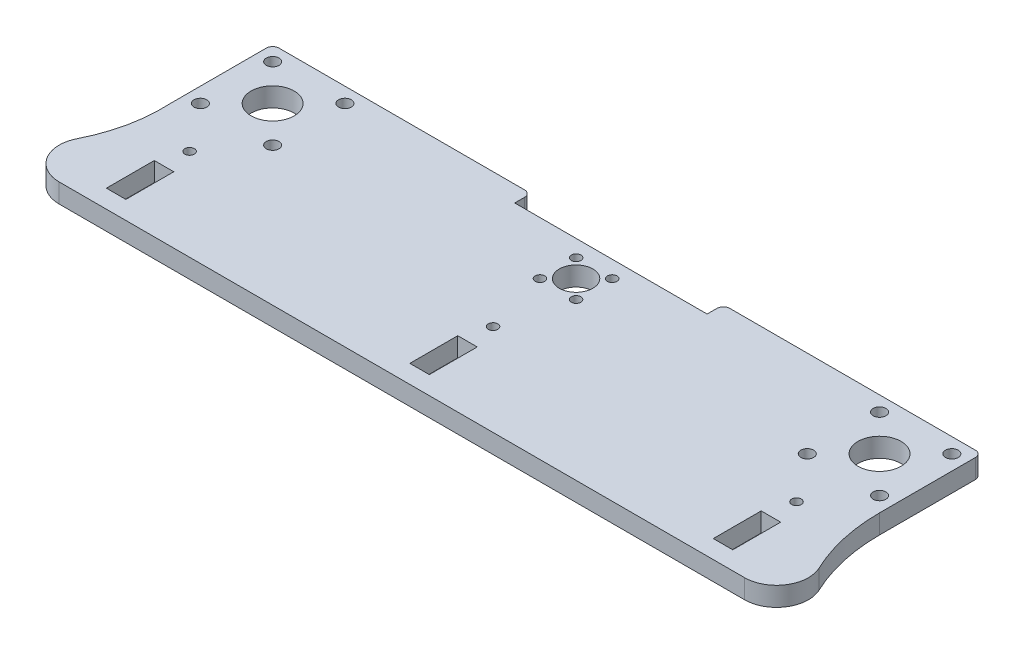
from build123d import *

# Parameters (mm, degrees)
CROQUIS1_R              = 5.25
CROQUIS1_R_2            = 6.75
CROQUIS1_R_3            = 2
CROQUIS1_R_4            = 1.5
CROQUIS1_W              = 6.1
CROQUIS1_H              = 15
SALIENTE_EXTRUIR1_DEPTH = 6


with BuildPart() as part:
    # Croquis1 → Saliente-Extruir1 (new body)
    with BuildSketch(Plane(origin=(0, 0, 0), x_dir=(1, 0, 0), z_dir=(0, 1, 0))):
        with BuildLine():
            Line((16.282727366, 43.644609037), (71.802987861, 43.644609037))
            Line((71.802987861, 43.644609037), (93.167350191, 43.644609037))
            ThreePointArc((93.167350191, 43.644609037), (94.581563754, 43.058822599), (95.167350191, 41.644609037))
            Line((95.167350191, 41.644609037), (95.167350191, 11.644653108))
            ThreePointArc((95.167350191, 11.644653108), (96.557023393, -0.870818798), (100.658344058, -12.7765904))
            ThreePointArc((100.658344058, -12.7765904), (100.070791822, -22.404752266), (91.620792474, -27.057088195))
            Line((91.620792474, -27.057088195), (-122.960915675, -27.057088195))
            ThreePointArc((-122.960915675, -27.057088195), (-131.47488844, -22.30230199), (-131.892437156, -12.559541748))
            ThreePointArc((-131.892437156, -12.559541748), (-127.777809493, -0.78872644), (-126.832649809, 11.644653108))
            Line((-126.832649809, 11.644653108), (-126.832649809, 41.644609037))
            ThreePointArc((-126.832649809, 41.644609037), (-126.246863371, 43.058822599), (-124.832649809, 43.644609037))
            Line((-124.832649809, 43.644609037), (-103.468287478, 43.644609037))
            Line((-103.468287478, 43.644609037), (-60.497048313, 43.644609037))
            Line((-60.497048313, 43.644609037), (-47.948026983, 43.644609037))
            ThreePointArc((-47.948026983, 43.644609037), (-46.533813421, 43.058822599), (-45.948026983, 41.644609037))
            Line((-45.948026983, 41.644609037), (-45.948026983, 38.554619052))
            Line((-45.948026983, 38.554619052), (14.282727366, 38.554619052))
            Line((14.282727366, 38.554619052), (14.282727366, 41.644609037))
            ThreePointArc((14.282727366, 41.644609037), (14.868513803, 43.058822599), (16.282727366, 43.644609037))
        make_face()
        with Locations(Location((-15.832649809, 27.644609037, 0), (0, 0, 270))):
            Circle(CROQUIS1_R, mode=Mode.SUBTRACT)
        with Locations(Location((-110.832649809, 27.644609037, 0), (0, 0, 270))):
            Circle(CROQUIS1_R_2, mode=Mode.SUBTRACT)
        with Locations(Location((79.167350191, 27.644609037, 0), (0, 0, 270))):
            Circle(CROQUIS1_R_2, mode=Mode.SUBTRACT)
        with Locations(Location((-99.51894131, 38.958317536, 0), (0, 0, 270))):
            Circle(CROQUIS1_R_3, mode=Mode.SUBTRACT)
        with Locations(Location((-122.146358308, 38.958317536, 0), (0, 0, 270))):
            Circle(CROQUIS1_R_3, mode=Mode.SUBTRACT)
        with Locations(Location((-99.51894131, 16.330900538, 0), (0, 0, 270))):
            Circle(CROQUIS1_R_3, mode=Mode.SUBTRACT)
        with Locations(Location((-122.146358308, 16.330900538, 0), (0, 0, 270))):
            Circle(CROQUIS1_R_3, mode=Mode.SUBTRACT)
        with Locations(Location((90.48105869, 16.330900538, 0), (0, 0, 270))):
            Circle(CROQUIS1_R_3, mode=Mode.SUBTRACT)
        with Locations(Location((67.853641692, 16.330900538, 0), (0, 0, 270))):
            Circle(CROQUIS1_R_3, mode=Mode.SUBTRACT)
        with Locations(Location((67.853641692, 38.958317536, 0), (0, 0, 270))):
            Circle(CROQUIS1_R_3, mode=Mode.SUBTRACT)
        with Locations(Location((-10.175795559, 33.301463286, 0), (0, 0, 270))):
            Circle(CROQUIS1_R_4, mode=Mode.SUBTRACT)
        with Locations(Location((-21.489504058, 33.301463286, 0), (0, 0, 270))):
            Circle(CROQUIS1_R_4, mode=Mode.SUBTRACT)
        with Locations(Location((-21.489504058, 21.987754787, 0), (0, 0, 270))):
            Circle(CROQUIS1_R_4, mode=Mode.SUBTRACT)
        with Locations(Location((-10.175795559, 21.987754787, 0), (0, 0, 270))):
            Circle(CROQUIS1_R_4, mode=Mode.SUBTRACT)
        with Locations(Location((-110.832649809, 1.644609037, 0), (0, 0, 270))):
            Circle(CROQUIS1_R_4, mode=Mode.SUBTRACT)
        with Locations(Location((79.167361237, 1.644649397, 0), (0, 0, 270))):
            Circle(CROQUIS1_R_4, mode=Mode.SUBTRACT)
        with Locations(Location((90.48105869, 38.958317536, 0), (0, 0, 270))):
            Circle(CROQUIS1_R_3, mode=Mode.SUBTRACT)
        with Locations(Location((-15.828049724, 1.644627362, 0), (0, 0, 270))):
            Circle(CROQUIS1_R_4, mode=Mode.SUBTRACT)
        with Locations((-110.832649809, -13.855390963)):
            Rectangle(CROQUIS1_W, CROQUIS1_H, mode=Mode.SUBTRACT)
        Polygon((76.117364636, -6.355351899), (76.117371009, -21.355351899), (82.217371009, -21.355349308), (82.217364636, -6.355349308), align=None, mode=Mode.SUBTRACT)
        Polygon((-18.88264641, -6.355351899), (-18.882640037, -21.355351899), (-12.782640037, -21.355349308), (-12.78264641, -6.355349308), align=None, mode=Mode.SUBTRACT)
    extrude(amount=SALIENTE_EXTRUIR1_DEPTH)


solid = part.part
